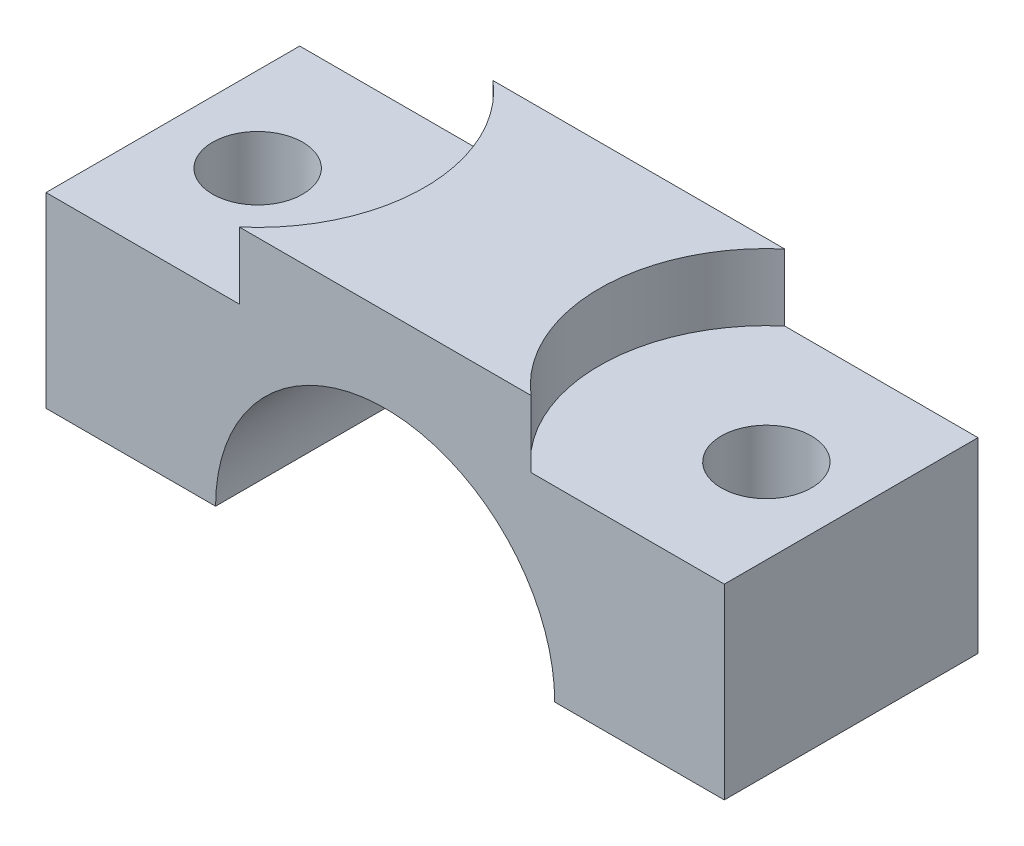
from build123d import *

# Parameters (mm, degrees)
BOSS_EXTRUDE1_DEPTH = 9.5
SKETCH2_R           = 3.375
CUT_EXTRUDE1_DEPTH  = 19
SKETCH2_3_R         = 3.375
CUT_EXTRUDE2_DEPTH  = 5


with BuildPart() as part:
    # Sketch1 → Boss-Extrude1 (new, symmetric)
    with BuildSketch(Plane.XY):
        with BuildLine():
            Line((-25.4, 0), (-12.7, 0))
            ThreePointArc((-12.7, 0), (0, 12.7), (12.7, 0))
            Line((12.7, 0), (25.4, 0))
            Line((25.4, 0), (25.4, 19))
            Line((25.4, 19), (-25.4, 19))
            Line((-25.4, 19), (-25.4, 0))
        make_face()
    extrude(amount=BOSS_EXTRUDE1_DEPTH, both=True)

    # Sketch2 → Cut-Extrude1 (cut)
    with BuildSketch(Plane(origin=(0, 19, 0), x_dir=(1, 0, 0), z_dir=(0, 1, 0))):
        with Locations((-19.05, 0)):
            Circle(SKETCH2_R)
        with Locations((19.05, 0)):
            Circle(SKETCH2_R)
    extrude(amount=-CUT_EXTRUDE1_DEPTH, mode=Mode.SUBTRACT)

    # Sketch2<3> → Cut-Extrude2 (cut)
    # profile 1 of 2: a face of its own
    with BuildSketch(Plane(origin=(0, 19, 0), x_dir=(1, 0, 0), z_dir=(0, 1, 0))):
        with BuildLine():
            Line((-25.4, -9.5), (-10.925961595, -9.5))
            ThreePointArc((-10.925961595, -9.5), (-6.55, 0), (-10.925961595, 9.5))
            Line((-10.925961595, 9.5), (-25.4, 9.5))
            Line((-25.4, 9.5), (-25.4, -9.5))
        make_face()
    # profile 2 of 2: a face of its own
    with BuildSketch(Plane(origin=(0, 19, 0), x_dir=(1, 0, 0), z_dir=(0, 1, 0))):
        with BuildLine():
            ThreePointArc((10.925961595, 9.5), (6.55, 0), (10.925961595, -9.5))
            Line((10.925961595, -9.5), (25.4, -9.5))
            Line((25.4, -9.5), (25.4, 9.5))
            Line((25.4, 9.5), (10.925961595, 9.5))
        make_face()
        with Locations((19.05, 0)):
            Circle(SKETCH2_3_R, mode=Mode.SUBTRACT)
    extrude(amount=-CUT_EXTRUDE2_DEPTH, mode=Mode.SUBTRACT)


solid = part.part
